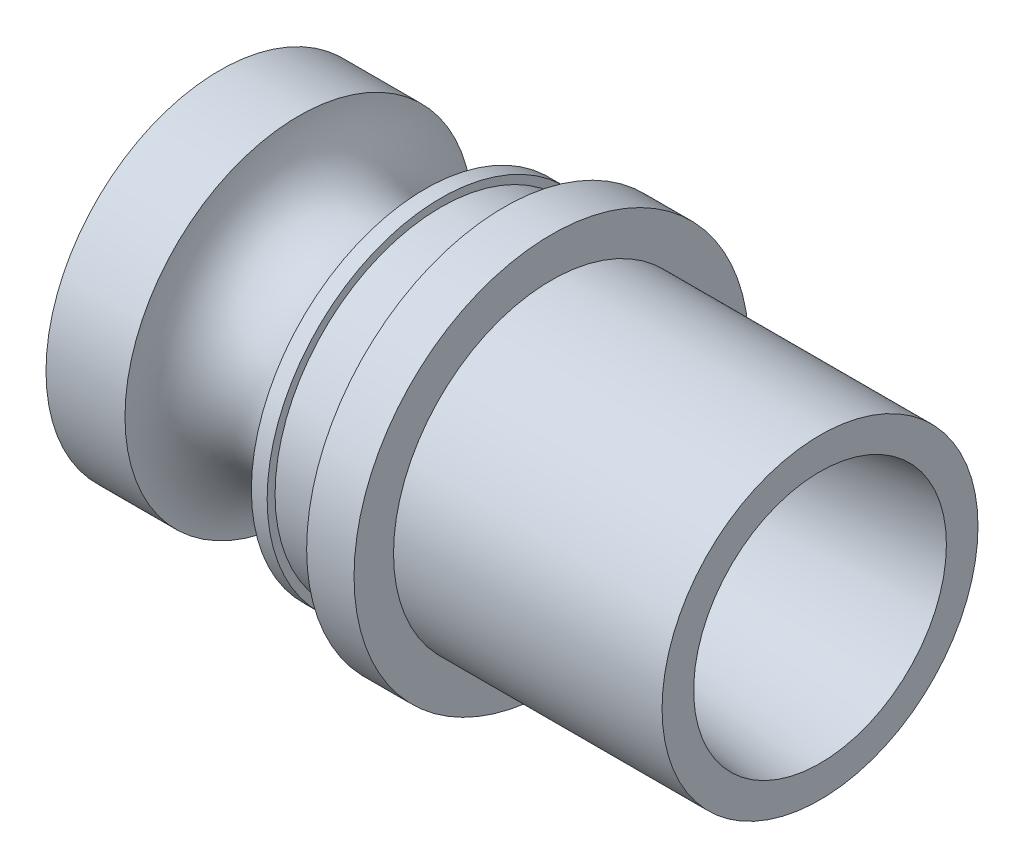
from build123d import *

# Parameters (mm, degrees)
SKETCH_2_R = 2


with BuildPart() as part:
    # Эскиз1 → Повернуть1 (revolve)
    with BuildSketch(Plane.XY, mode=Mode.PRIVATE) as revolve_1_sk:
        Polygon((-2.231746032, 0), (-21.231746032, 0), (-21.231746032, 5.5), (-14.231746032, 5.5), (-14.231746032, 5.25), (-12.231746032, 5.25), (-12.231746032, 6.25), (-10.731746032, 6.25), (-10.731746032, 5), (-2.231746032, 5), align=None)
    revolve(revolve_1_sk.sketch.rotate(Axis((-2.231746032, 0, 0), (-1, 0, 0)), 90), axis=Axis((-2.231746032, 0, 0), (-1, 0, 0)))

    # Эскиз2 → Вырез-Повернуть2 (revolve, cut)
    with BuildSketch(Plane.XY, mode=Mode.PRIVATE) as cut_revolve_2_sk:
        with Locations((-16.731746032, 5.5)):
            Circle(SKETCH_2_R)
        with BuildLine():
            Line((-2.231746032, 0), (-21.231746032, 0))
            Line((-21.231746032, 0), (-21.231746032, 5.039277614))
            ThreePointArc((-21.231746032, 5.039277614), (-18.822332125, 4.058469356), (-17.231746032, 2))
            Line((-17.231746032, 2), (-15.608822853, 2))
            Line((-15.608822853, 2), (-15.231746032, 2.518837092))
            Line((-15.231746032, 2.518837092), (-2.231746032, 4))
            Line((-2.231746032, 4), (-2.231746032, 0))
        make_face()
    revolve(cut_revolve_2_sk.sketch.rotate(Axis((-2.231746032, 0, 0), (-1, 0, 0)), 90), axis=Axis((-2.231746032, 0, 0), (-1, 0, 0)), mode=Mode.SUBTRACT)


solid = part.part
